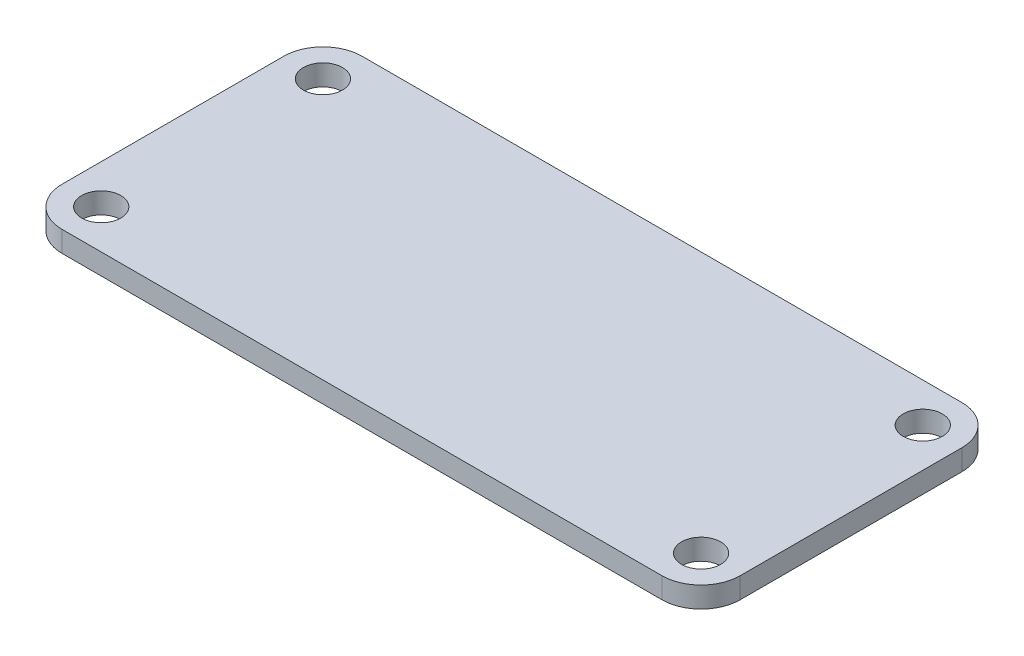
from build123d import *

# Parameters (mm, degrees)
SKETCH2_W           = 52
SKETCH2_H           = 23
BOSS_EXTRUDE1_DEPTH = 1.6
FILLET1_R           = 3
SKETCH5_R           = 1.5
CUT_EXTRUDE1_DEPTH  = 10


with BuildPart() as part:
    # Sketch2 → Boss-Extrude1 (new body)
    with BuildSketch(Plane(origin=(0, 0, 0), x_dir=(1, 0, 0), z_dir=(0, 1, 0))):
        Rectangle(SKETCH2_W, SKETCH2_H)
    extrude(amount=BOSS_EXTRUDE1_DEPTH)

    # Fillet1
    fillet1_edges = [part.edges().sort_by_distance(p)[0] for p in [
        (26, 0.8, 11.5),
        (-26, 0.8, 11.5),
        (-26, 0.8, -11.5),
        (26, 0.8, -11.5),
    ]]
    fillet(fillet1_edges, radius=FILLET1_R)

    # Sketch5 → Cut-Extrude1 (cut)
    with BuildSketch(Plane(origin=(0, 1.6, 0), x_dir=(1, 0, 0), z_dir=(0, 1, 0))):
        with Locations(Location((-23, 8.5, 0), (0, 0, 270))):
            Circle(SKETCH5_R)
        with Locations(Location((23, 8.5, 0), (0, 0, 270))):
            Circle(SKETCH5_R)
        with Locations(Location((23, -8.5, 0), (0, 0, 270))):
            Circle(SKETCH5_R)
        with Locations(Location((-23, -8.5, 0), (0, 0, 270))):
            Circle(SKETCH5_R)
    extrude(amount=-CUT_EXTRUDE1_DEPTH, mode=Mode.SUBTRACT)


solid = part.part
